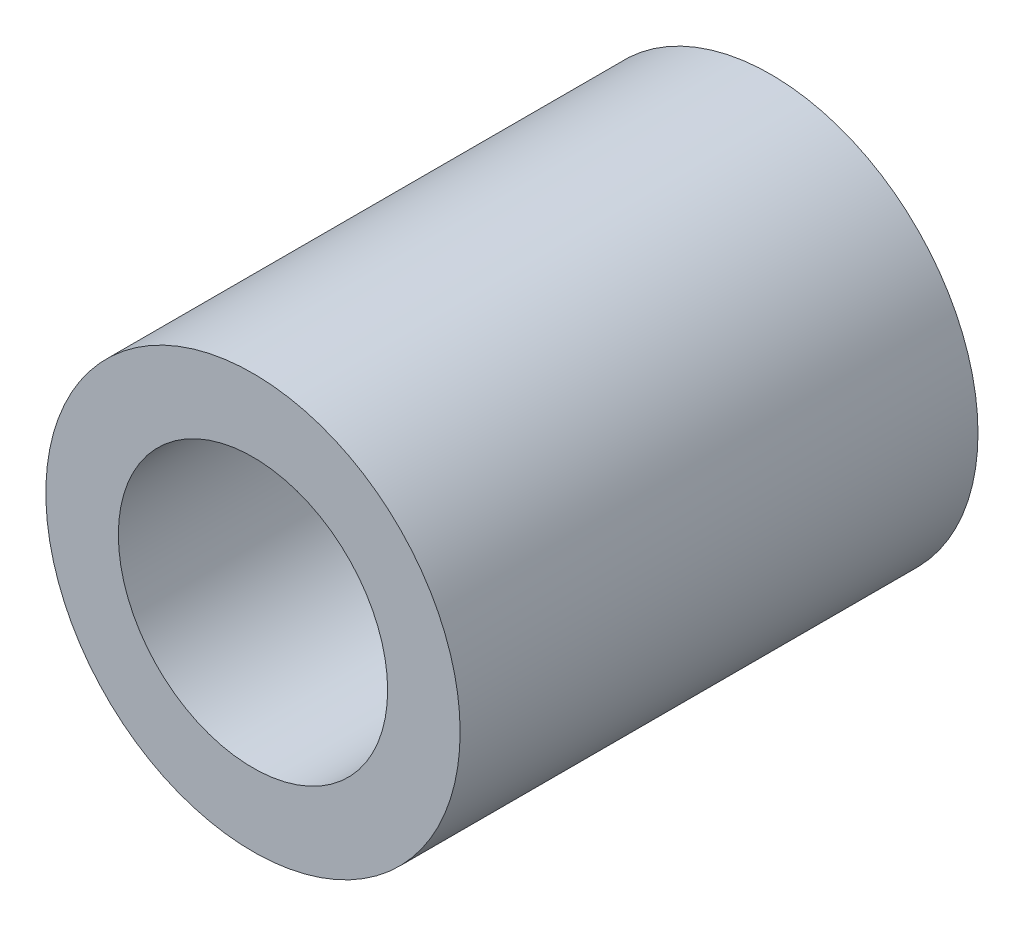
from build123d import *

# Parameters (mm, degrees)
SKETCH1_R           = 2
BOSS_EXTRUDE1_DEPTH = 5
SKETCH2_R           = 1.3
CUT_EXTRUDE1_DEPTH  = 6.744562647


with BuildPart() as part:
    # Sketch1 → Boss-Extrude1 (new body)
    with BuildSketch(Plane.XY):
        Circle(SKETCH1_R)
    extrude(amount=-BOSS_EXTRUDE1_DEPTH)

    # Sketch2 → Cut-Extrude1 (cut, through all)
    with BuildSketch(Plane.XY):
        Circle(SKETCH2_R)
    extrude(amount=-CUT_EXTRUDE1_DEPTH, mode=Mode.SUBTRACT)


solid = part.part
